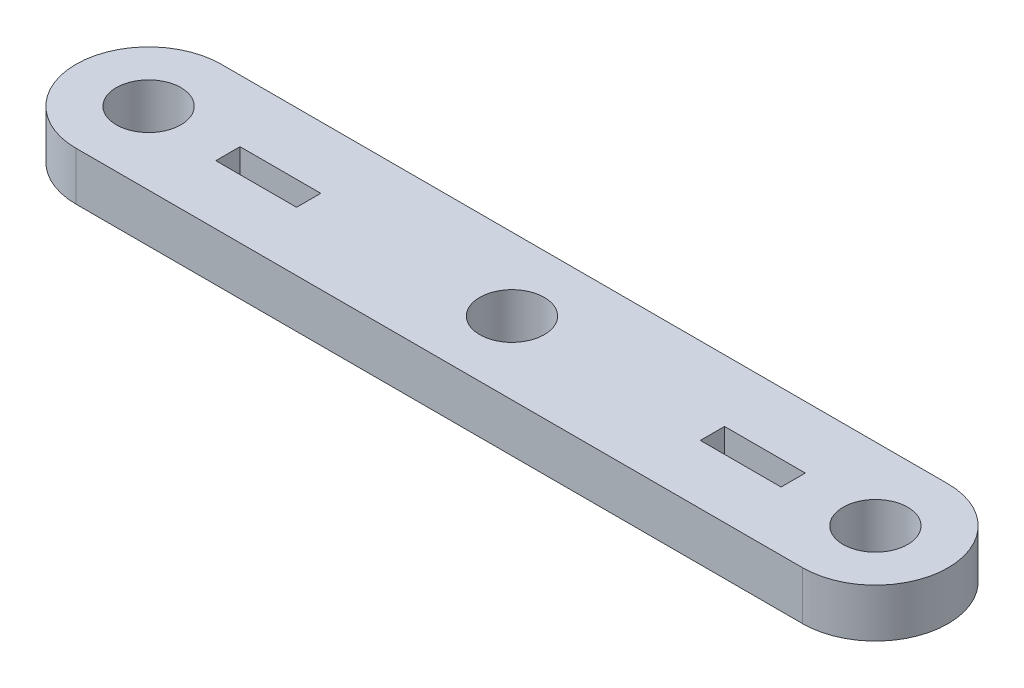
from build123d import *

# Parameters (mm, degrees)
BOSS_EXTRUDE1_DEPTH = 6
SKETCH3_R           = 4
CUT_EXTRUDE1_DEPTH  = 6
SKETCH4_W           = 10
SKETCH4_H           = 3
CUT_EXTRUDE2_DEPTH  = 6


with BuildPart() as part:
    # Sketch2 → Boss-Extrude1 (new body)
    with BuildSketch(Plane(origin=(0, 0, 0), x_dir=(1, 0, 0), z_dir=(0, 1, 0))):
        with BuildLine():
            Line((0, 0), (90, 0))
            ThreePointArc((90, 0), (99, 9), (90, 18))
            Line((90, 18), (0, 18))
            ThreePointArc((0, 18), (-9, 9), (0, 0))
        make_face()
    extrude(amount=BOSS_EXTRUDE1_DEPTH)

    # Sketch3 → Cut-Extrude1 (cut)
    with BuildSketch(Plane.XZ):
        with Locations(Location((0, -9, 0), (0, 0, 270))):
            Circle(SKETCH3_R)
        with Locations(Location((90, -9, 0), (0, 0, 90))):
            Circle(SKETCH3_R)
        with Locations(Location((45, -9, 0), (0, 0, 270))):
            Circle(SKETCH3_R)
    extrude(amount=-CUT_EXTRUDE1_DEPTH, mode=Mode.SUBTRACT)

    # Sketch4 → Cut-Extrude2 (cut)
    with BuildSketch(Plane(origin=(0, 6, 0), x_dir=(1, 0, 0), z_dir=(0, 1, 0))):
        with Locations((15, 8.821259453)):
            Rectangle(SKETCH4_W, SKETCH4_H)
        with Locations((75, 8.821259453)):
            Rectangle(SKETCH4_W, SKETCH4_H)
    extrude(amount=-CUT_EXTRUDE2_DEPTH, mode=Mode.SUBTRACT)


solid = part.part
